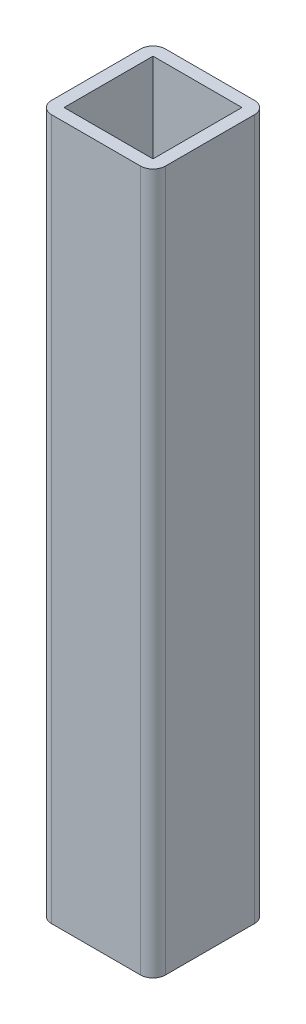
from build123d import *

# Parameters (mm, degrees)
BOSS_EXTRUDE1_DEPTH = 157.52
SKETCH3_W           = 20
SKETCH3_H           = 20
CUT_EXTRUDE1_DEPTH  = 1040.5


with BuildPart() as part:
    # Sketch1 → Boss-Extrude1 (new body)
    with BuildSketch(Plane(origin=(0, 0, 0), x_dir=(1, 0, 0), z_dir=(0, 1, 0))):
        with BuildLine():
            Line((2.8, 0), (22.8, 0))
            ThreePointArc((22.8, 0), (24.779898987, -0.820101013), (25.6, -2.8))
            Line((25.6, -2.8), (25.6, -22.8))
            ThreePointArc((25.6, -22.8), (24.779898987, -24.779898987), (22.8, -25.6))
            Line((22.8, -25.6), (2.8, -25.6))
            ThreePointArc((2.8, -25.6), (0.820101013, -24.779898987), (0, -22.8))
            Line((0, -22.8), (0, -2.8))
            ThreePointArc((0, -2.8), (0.820101013, -0.820101013), (2.8, 0))
        make_face()
    extrude(amount=BOSS_EXTRUDE1_DEPTH)

    # Sketch3 → Cut-Extrude1 (cut)
    with BuildSketch(Plane(origin=(0, 0, 0), x_dir=(-1, 0, 0), z_dir=(0, -1, 0))):
        with Locations((-12.8, -12.8)):
            Rectangle(SKETCH3_W, SKETCH3_H)
    extrude(amount=-CUT_EXTRUDE1_DEPTH, mode=Mode.SUBTRACT)


solid = part.part
